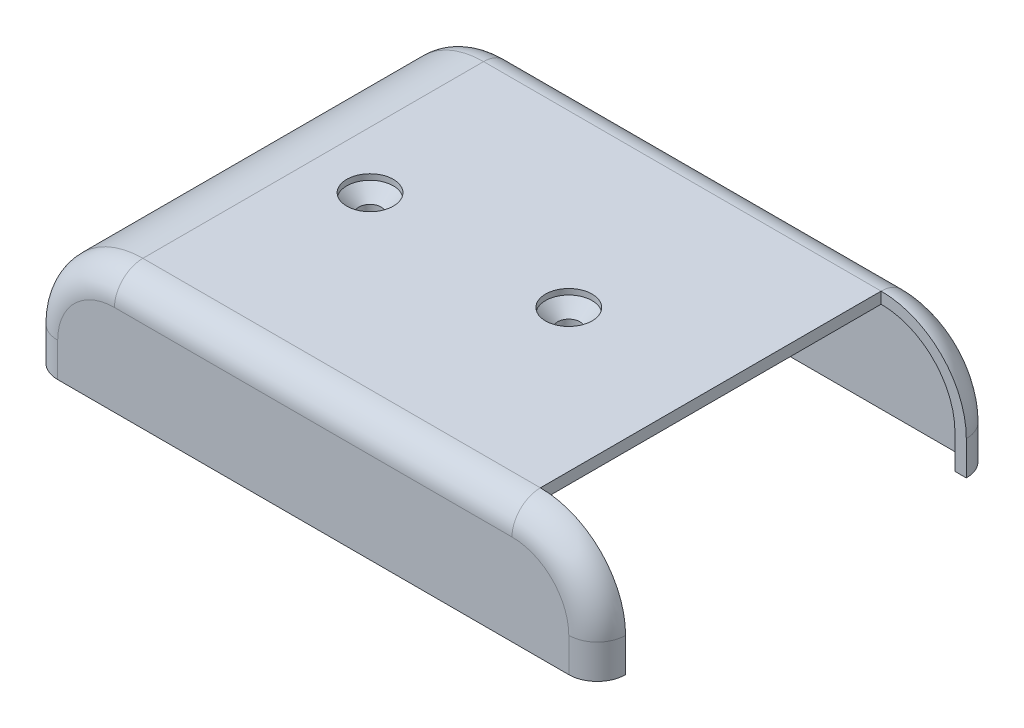
from build123d import *

# Parameters (mm, degrees)
SKETCH1_W                                     = 100
SKETCH1_H                                     = 70
BOSS_EXTRUDE1_DEPTH                           = 21
FILLET1_R                                     = 15
FILLET2_R                                     = 5
SHELL1_T                                      = -2
SKETCH2_W                                     = 34.075485645
SKETCH2_H                                     = 60
CUT_EXTRUDE1_DEPTH                            = 45
BOSS_EXTRUDE2_REACH                           = 64.849
SKETCH4_R                                     = 3
BOSS_EXTRUDE2_DRAFT                           = -5
CSK_FOR_M10_FLAT_HEAD_MACHINE_SCREW4_AT_COUNT = 2
CSK_FOR_M10_FLAT_HEAD_MACHINE_SCREW4_AT_PITCH = 35


with BuildPart() as part:
    # Sketch1 → Boss-Extrude1 (new body)
    with BuildSketch(Plane(origin=(0, 0, 0), x_dir=(1, 0, 0), z_dir=(0, 1, 0))):
        Rectangle(SKETCH1_W, SKETCH1_H)
    extrude(amount=BOSS_EXTRUDE1_DEPTH)

    # Fillet1
    fillet1_edges = [part.edges().sort_by_distance(p)[0] for p in [
        (-50, 21, 0),
        (50, 21, 0),
    ]]
    fillet(fillet1_edges, radius=FILLET1_R)

    # Fillet2
    fillet2_edges = [part.edges().sort_by_distance(p)[0] for p in [
        (0, 21, -35),
        (0, 21, 35),
        (-50, 3, -35),
        (50, 3, -35),
        (-45.606601718, 16.606601718, -35),
        (45.606601718, 16.606601718, -35),
        (50, 3, 35),
        (-50, 3, 35),
        (-45.606601718, 16.606601718, 35),
        (45.606601718, 16.606601718, 35),
    ]]
    fillet(fillet2_edges, radius=FILLET2_R)

    # Shell1
    shell1_openings = [part.faces().sort_by_distance(p)[0] for p in [
        (0, 0, 0),
    ]]
    offset(amount=SHELL1_T, openings=shell1_openings, kind=Kind.INTERSECTION)

    # Sketch2 → Cut-Extrude1 (cut)
    with BuildSketch(Plane(origin=(0, 21, 0), x_dir=(1, 0, 0), z_dir=(0, 1, 0))):
        with Locations((52.037742823, 0)):
            Rectangle(SKETCH2_W, SKETCH2_H)
    extrude(amount=-CUT_EXTRUDE1_DEPTH, mode=Mode.SUBTRACT)




with BuildPart() as boss_extrude2_long_prism_1:
    # Sketch4 → Boss-Extrude2 (the long prism of profile 1, to be tilted and cut off)
    with BuildSketch(Plane(origin=(0, 6, 0), x_dir=(1, 0, 0), z_dir=(0, 1, 0))):
        with Locations((-25, 0)):
            Circle(SKETCH4_R)
    extrude(amount=BOSS_EXTRUDE2_REACH)
    boss_extrude2_tool1_sides = [boss_extrude2_long_prism_1.faces().sort_by_distance(p)[0] for p in [
        (-28, 38.4245, 0),
    ]]
    draft(boss_extrude2_tool1_sides, Plane(origin=(0, 6, 0), x_dir=(1, 0, 0), z_dir=(0, 1, 0)), BOSS_EXTRUDE2_DRAFT)  # the draft: side faces tilted about the start plane


with BuildPart() as part_1:
    add(part.part)
    boss_extrude2_tool1 = boss_extrude2_long_prism_1.part - part.part



with BuildPart() as boss_extrude2_long_prism_2:
    # Sketch4 → Boss-Extrude2 (the long prism of profile 2, to be tilted and cut off)
    with BuildSketch(Plane(origin=(0, 6, 0), x_dir=(1, 0, 0), z_dir=(0, 1, 0))):
        with Locations((10, 0)):
            Circle(SKETCH4_R)
    extrude(amount=BOSS_EXTRUDE2_REACH)
    boss_extrude2_tool2_sides = [boss_extrude2_long_prism_2.faces().sort_by_distance(p)[0] for p in [
        (7, 38.4245, 0),
    ]]
    draft(boss_extrude2_tool2_sides, Plane(origin=(0, 6, 0), x_dir=(1, 0, 0), z_dir=(0, 1, 0)), BOSS_EXTRUDE2_DRAFT)  # the draft: side faces tilted about the start plane


with BuildPart() as part_2:
    add(part_1.part)
    boss_extrude2_tool2 = boss_extrude2_long_prism_2.part - part.part
    add(boss_extrude2_tool1.solids().sort_by_distance((-25, 6, 0))[0])
    add(boss_extrude2_tool2.solids().sort_by_distance((10, 6, 0))[0])

    # Sketch13 → CSK for M10 Flat Head Machine Screw4 (revolve, cut)
    with BuildSketch(Plane(origin=(-25, 21, 0), x_dir=(0, 0, 1), z_dir=(1, 0, 0))):
        Polygon((0, 0), (0, 15), (1.95, 15), (1.95, 3.15), (4.1, 1), (4.1, 0), align=None)
    csk_for_m10_flat_head_machine_screw4 = revolve(axis=Axis((-25, 27.35, 0), (0, -1, 0)), mode=Mode.SUBTRACT)

    # CSK for M10 Flat Head Machine Screw4 at: CSK for M10 Flat Head Machine Screw4 ×2
    with Locations(*[(i * CSK_FOR_M10_FLAT_HEAD_MACHINE_SCREW4_AT_PITCH, 0, 0) for i in range(1, CSK_FOR_M10_FLAT_HEAD_MACHINE_SCREW4_AT_COUNT)]):
        add(csk_for_m10_flat_head_machine_screw4, mode=Mode.SUBTRACT)


solid = part_2.part
